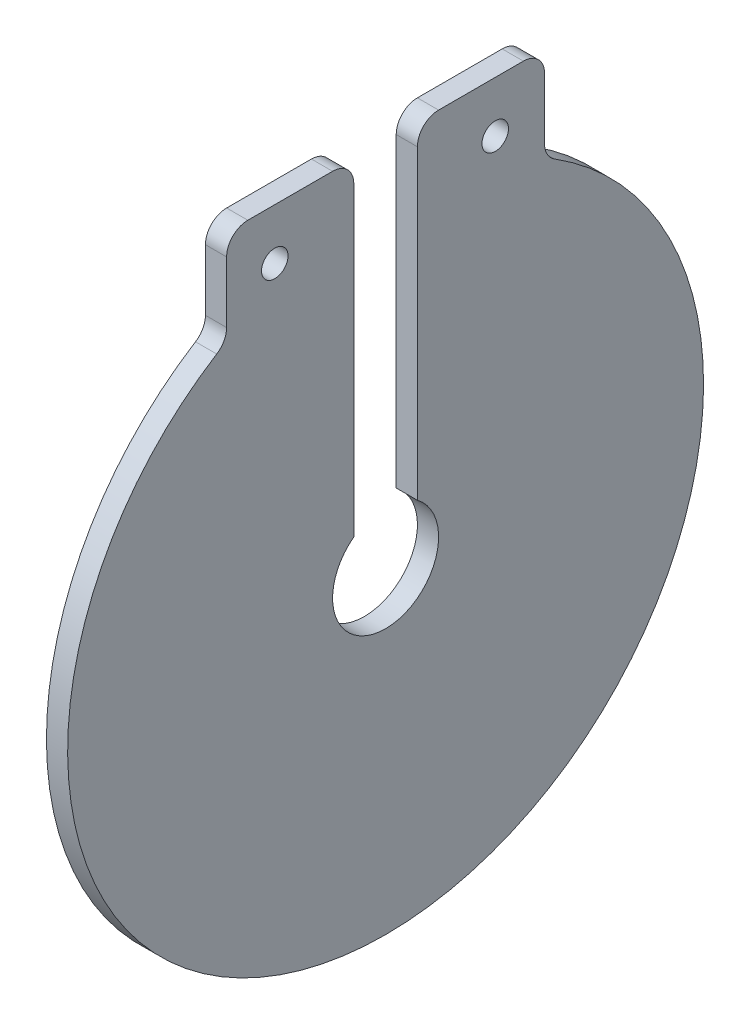
from build123d import *

# Parameters (mm, degrees)
SKETCH_1_R          = 30
EXTRUDE_1_DEPTH     = 2
SKETCH_2_R          = 5
CUT_EXTRUDE_1_DEPTH = 2
SKETCH_5_W          = 30
SKETCH_5_H          = 8.9
EXTRUDE_2_DEPTH     = 2
SKETCH_4_W          = 6
SKETCH_4_H          = 36.621783582
CUT_EXTRUDE_3_DEPTH = 2
FILLET_1_R          = 2
SKETCH_6_R          = 1.25
CUT_EXTRUDE_4_DEPTH = 2


with BuildPart() as part:
    # 草图1 → 凸台-拉伸1 (new body)
    with BuildSketch(Plane(origin=(0, 0, 0), x_dir=(0, 0, -1), z_dir=(1, 0, 0))):
        Circle(SKETCH_1_R)
    extrude(amount=EXTRUDE_1_DEPTH)

    # 草图2 → 切除-拉伸1 (cut)
    with BuildSketch(Plane(origin=(2, 0, 0), x_dir=(0, 0, -1), z_dir=(1, 0, 0))):
        Circle(SKETCH_2_R)
    extrude(amount=-CUT_EXTRUDE_1_DEPTH, mode=Mode.SUBTRACT)

    # 草图5 → 凸台-拉伸2 (add)
    with BuildSketch(Plane(origin=(2, 0, 0), x_dir=(0, 0, -1), z_dir=(1, 0, 0))):
        with Locations((0, 30.430762114)):
            Rectangle(SKETCH_5_W, SKETCH_5_H)
    extrude(amount=-EXTRUDE_2_DEPTH)

    # 草图4 → 切除-拉伸3 (cut)
    with BuildSketch(Plane(origin=(2, 0, 0), x_dir=(0, 0, -1), z_dir=(1, 0, 0))):
        with Locations((0, 20.061807767)):
            Rectangle(SKETCH_4_W, SKETCH_4_H)
    extrude(amount=-CUT_EXTRUDE_3_DEPTH, mode=Mode.SUBTRACT)

    # 圆角1
    fillet_1_edges = [part.edges().sort_by_distance(p)[0] for p in [
        (1, 25.980762114, 15),
        (1, 34.880762114, 15),
        (1, 34.880762114, -15),
        (1, 25.980762114, -15),
        (1, 34.880762114, -3),
        (1, 34.880762114, 3),
    ]]
    fillet(fillet_1_edges, radius=FILLET_1_R)

    # 草图6 → 切除-拉伸4 (cut)
    with BuildSketch(Plane(origin=(2, 0, 0), x_dir=(0, 0, -1), z_dir=(1, 0, 0))):
        with Locations((-10.455602866, 30.080762114)):
            Circle(SKETCH_6_R)
        with Locations((10.344397134, 30.080762114)):
            Circle(SKETCH_6_R)
    extrude(amount=-CUT_EXTRUDE_4_DEPTH, mode=Mode.SUBTRACT)


solid = part.part
